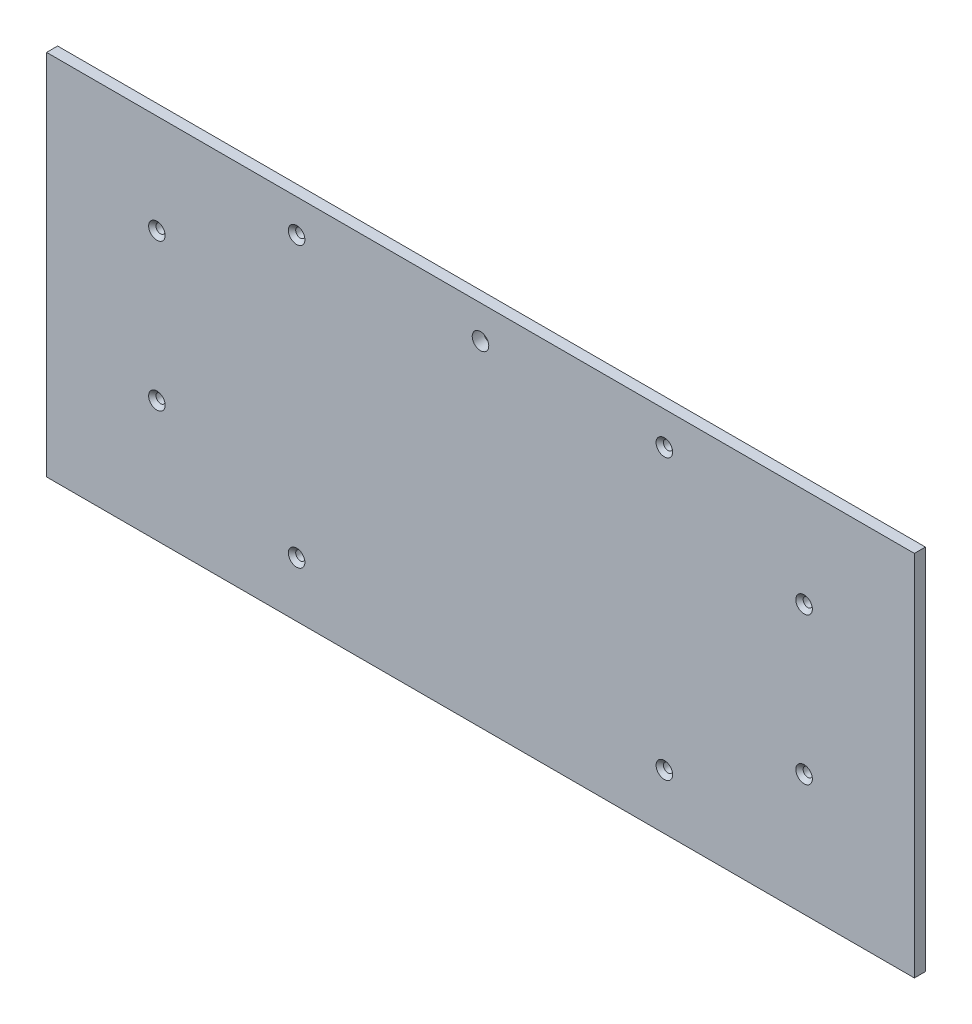
from build123d import *

# Parameters (mm, degrees)
ESQUISSE1_W             = 472
ESQUISSE1_H             = 200
BOSS_EXTRU_1_DEPTH      = 6
ESQUISSE2_R             = 2.5
ENL_V_MAT_EXTRU_1_DEPTH = 257.382526706
CHANFREIN1_SIZE         = 2
ESQUISSE4_R             = 4.5
ENL_V_MAT_EXTRU_2_DEPTH = 257.382526706


with BuildPart() as part:
    # Esquisse1 → Boss.-Extru.1 (new body)
    with BuildSketch(Plane.XY):
        Rectangle(ESQUISSE1_W, ESQUISSE1_H)
    extrude(amount=BOSS_EXTRU_1_DEPTH)

    # Esquisse2 → Enlèv. mat.-Extru.1 (cut, through all)
    with BuildSketch(Plane.XY.offset(6)):
        with Locations((100, -70)):
            Circle(ESQUISSE2_R)
        with Locations((-100, -70)):
            Circle(ESQUISSE2_R)
        with Locations((-100, 82)):
            Circle(ESQUISSE2_R)
        with Locations((100, 82)):
            Circle(ESQUISSE2_R)
        with Locations((176, -34)):
            Circle(ESQUISSE2_R)
        with Locations((176, 46)):
            Circle(ESQUISSE2_R)
        with Locations((-176, 46)):
            Circle(ESQUISSE2_R)
        with Locations((-176, -34)):
            Circle(ESQUISSE2_R)
    extrude(amount=-ENL_V_MAT_EXTRU_1_DEPTH, mode=Mode.SUBTRACT)

    # Chanfrein1
    chanfrein1_edges = [part.edges().sort_by_distance(p)[0] for p in [
        (-102.5, -70, 6),
        (-102.5, 82, 6),
        (97.5, 82, 6),
        (173.5, 46, 6),
        (-178.5, -34, 6),
        (-178.5, 46, 6),
        (173.5, -34, 6),
        (97.5, -70, 6),
    ]]
    chamfer(chanfrein1_edges, length=CHANFREIN1_SIZE)

    # Esquisse4 → Enlèv. mat.-Extru.2 (cut, through all)
    with BuildSketch(Plane.XY.offset(6)):
        with Locations((0, 82)):
            Circle(ESQUISSE4_R)
    extrude(amount=-ENL_V_MAT_EXTRU_2_DEPTH, mode=Mode.SUBTRACT)


solid = part.part
